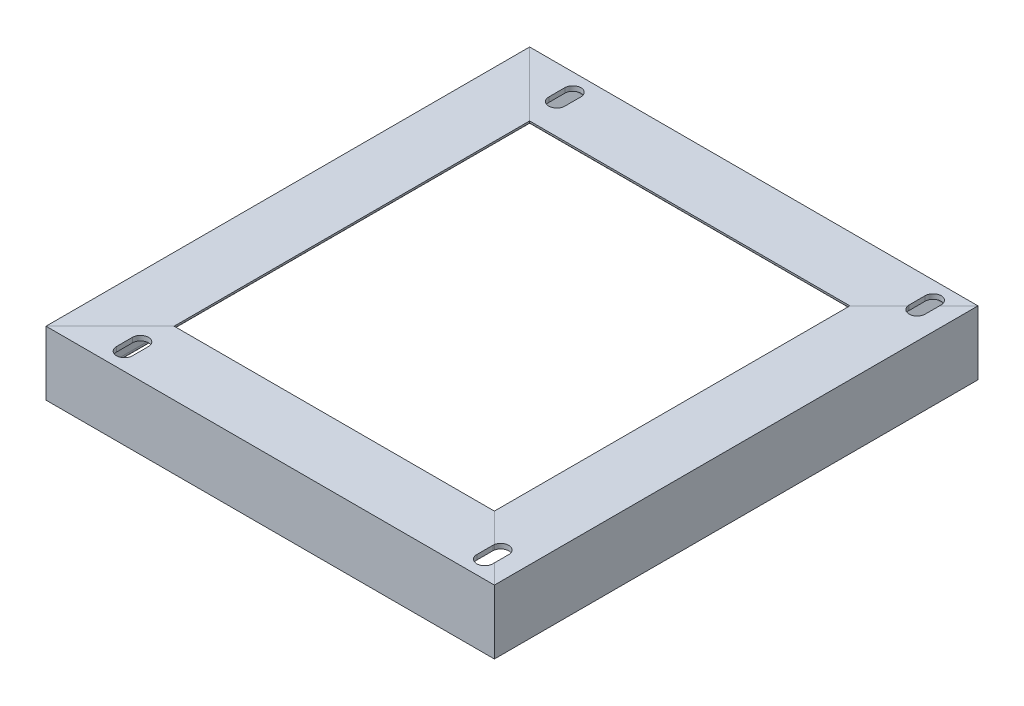
from build123d import *

# Parameters (mm, degrees)
IRON_V40X40X3_2_DEPTH      = 359.568542495
IRON_V40X40X3_2_DEPTH_BACK = 57.568542495
IRON_V40X40X3_2_2_DEPTH    = 395.13708499
IRON_V40X40X3_2_3_DEPTH    = 417.13708499
IRON_V40X40X3_2_4_DEPTH    = 395.13708499
CUT_EXTRUDE2_START         = 10
CUT_EXTRUDE2_DEPTH         = 20


with BuildPart() as part:
    # Sketch1 → Iron V40X40X3(2) (new, two sides: drawn at the far end of the back side and taken through both)
    with BuildSketch(Plane(origin=(-140, 0, 151), x_dir=(1, 0, 0), z_dir=(0, 0, -1)).offset(-IRON_V40X40X3_2_DEPTH_BACK)):
        with BuildLine():
            Line((0, 0), (0, 40))
            ThreePointArc((0, 40), (2.121320344, 39.121320344), (3, 37))
            Line((3, 37), (3, 6.5))
            ThreePointArc((3, 6.5), (4.025126266, 4.025126266), (6.5, 3))
            Line((6.5, 3), (37, 3))
            ThreePointArc((37, 3), (39.121320344, 2.121320344), (40, 0))
            Line((40, 0), (0, 0))
        make_face()
    extrude(amount=IRON_V40X40X3_2_DEPTH + IRON_V40X40X3_2_DEPTH_BACK)

    # Iron V40X40X3(2) mitre 1
    split(bisect_by=Plane(origin=(-140, 0, 151), x_dir=(0, -1, 0), z_dir=(-0.707106781, 0, -0.707106781)), keep=Keep.TOP)

    # Iron V40X40X3(2) mitre 2
    split(bisect_by=Plane(origin=(-140, 0, -151), x_dir=(0, -1, 0), z_dir=(-0.707106781, 0, 0.707106781)), keep=Keep.TOP)


with BuildPart() as body_2:
    # Sketch1 on segment 2 (carried to segment 2) → Iron V40X40X3_2 2 (new body)
    with BuildSketch(Plane(origin=(-197.568542495, 0, -151), x_dir=(0, 0, 1), z_dir=(1, 0, 0))):
        with BuildLine():
            Line((0, 0), (0, 40))
            ThreePointArc((0, 40), (2.121320344, 39.121320344), (3, 37))
            Line((3, 37), (3, 6.5))
            ThreePointArc((3, 6.5), (4.025126266, 4.025126266), (6.5, 3))
            Line((6.5, 3), (37, 3))
            ThreePointArc((37, 3), (39.121320344, 2.121320344), (40, 0))
            Line((40, 0), (0, 0))
        make_face()
    extrude(amount=IRON_V40X40X3_2_2_DEPTH)

    # Iron V40X40X3_2 2 mitre 1
    split(bisect_by=Plane(origin=(140, 0, -151), x_dir=(0, -1, 0), z_dir=(-0.707106781, 0, -0.707106781)), keep=Keep.TOP)

    # Iron V40X40X3_2 2 mitre 2
    split(bisect_by=Plane(origin=(-140, 0, -151), x_dir=(0, 1, 0), z_dir=(0.707106781, 0, -0.707106781)), keep=Keep.TOP)


with BuildPart() as body_3:
    # Sketch1 on segment 3 (carried to segment 3) → Iron V40X40X3_2 3 (new body)
    with BuildSketch(Plane(origin=(140, 0, -208.568542495), x_dir=(-1, 0, 0), z_dir=(0, 0, 1))):
        with BuildLine():
            Line((0, 0), (0, 40))
            ThreePointArc((0, 40), (2.121320344, 39.121320344), (3, 37))
            Line((3, 37), (3, 6.5))
            ThreePointArc((3, 6.5), (4.025126266, 4.025126266), (6.5, 3))
            Line((6.5, 3), (37, 3))
            ThreePointArc((37, 3), (39.121320344, 2.121320344), (40, 0))
            Line((40, 0), (0, 0))
        make_face()
    extrude(amount=IRON_V40X40X3_2_3_DEPTH)

    # Iron V40X40X3_2 3 mitre 1
    split(bisect_by=Plane(origin=(140, 0, 151), x_dir=(0, 1, 0), z_dir=(0.707106781, 0, -0.707106781)), keep=Keep.TOP)

    # Iron V40X40X3_2 3 mitre 2
    split(bisect_by=Plane(origin=(140, 0, -151), x_dir=(0, 1, 0), z_dir=(0.707106781, 0, 0.707106781)), keep=Keep.TOP)


with BuildPart() as body_4:
    # Sketch1 on segment 4 (carried to segment 4) → Iron V40X40X3_2 4 (new body)
    with BuildSketch(Plane(origin=(197.568542495, 0, 151), x_dir=(0, 0, -1), z_dir=(-1, 0, 0))):
        with BuildLine():
            Line((0, 0), (0, 40))
            ThreePointArc((0, 40), (2.121320344, 39.121320344), (3, 37))
            Line((3, 37), (3, 6.5))
            ThreePointArc((3, 6.5), (4.025126266, 4.025126266), (6.5, 3))
            Line((6.5, 3), (37, 3))
            ThreePointArc((37, 3), (39.121320344, 2.121320344), (40, 0))
            Line((40, 0), (0, 0))
        make_face()
    extrude(amount=IRON_V40X40X3_2_4_DEPTH)

    # Iron V40X40X3_2 4 mitre 1
    split(bisect_by=Plane(origin=(140, 0, 151), x_dir=(0, -1, 0), z_dir=(-0.707106781, 0, 0.707106781)), keep=Keep.TOP)

    # Iron V40X40X3_2 4 mitre 2
    split(bisect_by=Plane(origin=(-140, 0, 151), x_dir=(0, 1, 0), z_dir=(0.707106781, 0, 0.707106781)), keep=Keep.TOP)


with BuildPart() as cut_extrude2_tool:
    # Sketch2 → Cut-Extrude2 (new body)
    with BuildSketch(Plane(origin=(0, 0, 0), x_dir=(1, 0, 0), z_dir=(0, 1, 0)).offset(CUT_EXTRUDE2_START)):
        with BuildLine():
            Line((-97, 140), (-97, 130))
            ThreePointArc((-97, 130), (-102, 125), (-107, 130))
            Line((-107, 130), (-107, 140))
            ThreePointArc((-107, 140), (-102, 145), (-97, 140))
        make_face()
        with BuildLine():
            Line((128, 140), (128, 130))
            ThreePointArc((128, 130), (123, 125), (118, 130))
            Line((118, 130), (118, 140))
            ThreePointArc((118, 140), (123, 145), (128, 140))
        make_face()
        with BuildLine():
            Line((128, -130), (128, -140))
            ThreePointArc((128, -140), (123, -145), (118, -140))
            Line((118, -140), (118, -130))
            ThreePointArc((118, -130), (123, -125), (128, -130))
        make_face()
        with BuildLine():
            Line((-97, -130), (-97, -140))
            ThreePointArc((-97, -140), (-102, -145), (-107, -140))
            Line((-107, -140), (-107, -130))
            ThreePointArc((-107, -130), (-102, -125), (-97, -130))
        make_face()
    extrude(amount=-CUT_EXTRUDE2_DEPTH)


with BuildPart() as body_2_1:
    add(body_2.part)

    # Cut-Extrude2: cut by cut_extrude2_tool
    add(cut_extrude2_tool.part, mode=Mode.SUBTRACT)


with BuildPart() as body_3_1:
    add(body_3.part)

    # Cut-Extrude2: cut by cut_extrude2_tool
    add(cut_extrude2_tool.part, mode=Mode.SUBTRACT)


with BuildPart() as body_4_1:
    add(body_4.part)

    # Cut-Extrude2: cut by cut_extrude2_tool
    add(cut_extrude2_tool.part, mode=Mode.SUBTRACT)


solid = Compound([part.part, body_2_1.part, body_3_1.part, body_4_1.part])
